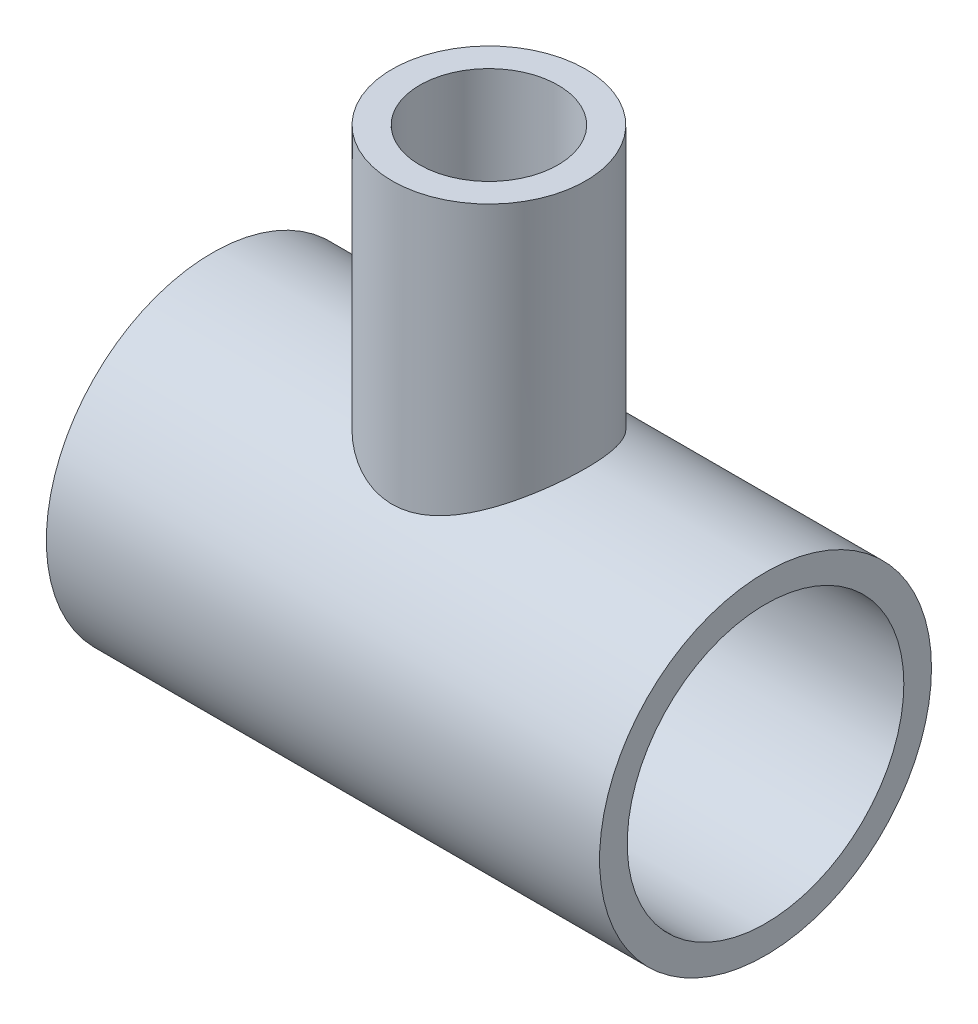
from build123d import *

# Parameters (mm, degrees)
SKETCH1_R               = 7.62
BOSS_EXTRUDE1_DEPTH     = 25.4
SKETCH2_R               = 4.445
BOSS_EXTRUDE2_DEPTH     = 19.05
SKETCH3_R               = 6.35
CUT_EXTRUDE1_DEPTH      = 33.651598895
CUT_EXTRUDE2_REACH      = 39.61
CUT_EXTRUDE2_END_RADIUS = 6.35
SKETCH4_R               = 3.175


with BuildPart() as part:
    # Sketch1 → Boss-Extrude1 (new body)
    with BuildSketch(Plane(origin=(0, 0, 0), x_dir=(0, 0, -1), z_dir=(1, 0, 0))):
        Circle(SKETCH1_R)
    extrude(amount=BOSS_EXTRUDE1_DEPTH)

    # Sketch2 → Boss-Extrude2 (add)
    with BuildSketch(Plane(origin=(0, 0, 0), x_dir=(1, 0, 0), z_dir=(0, 1, 0))):
        with Locations(Location((12.7, 0, 0), (0, 0, 90))):
            Circle(SKETCH2_R)
    extrude(amount=BOSS_EXTRUDE2_DEPTH)

    # Sketch3 → Cut-Extrude1 (cut, through all)
    with BuildSketch(Plane(origin=(25.4, 0, 0), x_dir=(0, 0, -1), z_dir=(1, 0, 0))):
        Circle(SKETCH3_R)
    extrude(amount=-CUT_EXTRUDE1_DEPTH, mode=Mode.SUBTRACT)

    # Cut-Extrude2: up to this cylinder (the profile starts outside it)
    cut_extrude2_end = Plane(origin=(12.7, 0, 0), z_dir=(1, 0, 0)) * Cylinder(CUT_EXTRUDE2_END_RADIUS, 92.92, mode=Mode.PRIVATE)
    # Sketch4 → Cut-Extrude2 (cut, up to the surface)
    with BuildSketch(Plane(origin=(0, 19.05, 0), x_dir=(1, 0, 0), z_dir=(0, 1, 0)), mode=Mode.PRIVATE) as cut_extrude2_sk1:
        with Locations(Location((12.7, 0, 0), (0, 0, 270))):
            Circle(SKETCH4_R)
    cut_extrude2_tool1 = extrude(cut_extrude2_sk1.sketch, amount=-CUT_EXTRUDE2_REACH, mode=Mode.PRIVATE) - cut_extrude2_end
    add(cut_extrude2_tool1.solids().sort_by_distance((12.7, 19.05, 0))[0], mode=Mode.SUBTRACT)


solid = part.part
